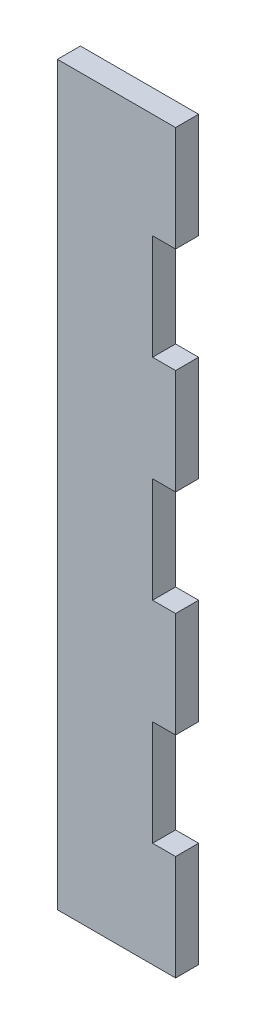
from build123d import *

# Parameters (mm, degrees)
SKETCH1_W           = 6.35
SKETCH1_H           = 203.2
SKETCH1_H_2         = 29.028571429
BOSS_EXTRUDE1_DEPTH = 6.35
SKETCH2_W           = 6.35
SKETCH2_H           = 203.2
BOSS_EXTRUDE2_DEPTH = 13.56


with BuildPart() as part:
    # Sketch1 → Boss-Extrude1 (new body)
    with BuildSketch(Plane.XY):
        with Locations((-3.175, 0)):
            Rectangle(SKETCH1_W, SKETCH1_H)
        Polygon((6.35, 101.6), (0, 101.6), (0, -101.6), (6.35, -101.6), (6.35, -72.571428571), (6.35, -43.542857143), (6.35, -14.514285714), (6.35, 14.514285714), (6.35, 43.542857143), (6.35, 72.571428571), align=None)
        with Locations((9.525, 87.085714286)):
            Rectangle(SKETCH1_W, SKETCH1_H_2)
        with Locations((9.525, 29.028571429)):
            Rectangle(SKETCH1_W, SKETCH1_H_2)
        with Locations((9.525, -29.028571429)):
            Rectangle(SKETCH1_W, SKETCH1_H_2)
        with Locations((9.525, -87.085714286)):
            Rectangle(SKETCH1_W, SKETCH1_H_2)
    extrude(amount=BOSS_EXTRUDE1_DEPTH)

    # Sketch2 → Boss-Extrude2 (add)
    with BuildSketch(Plane.ZY.offset(6.35)):
        with Locations((3.175, 0)):
            Rectangle(SKETCH2_W, SKETCH2_H)
    extrude(amount=BOSS_EXTRUDE2_DEPTH)


solid = part.part
